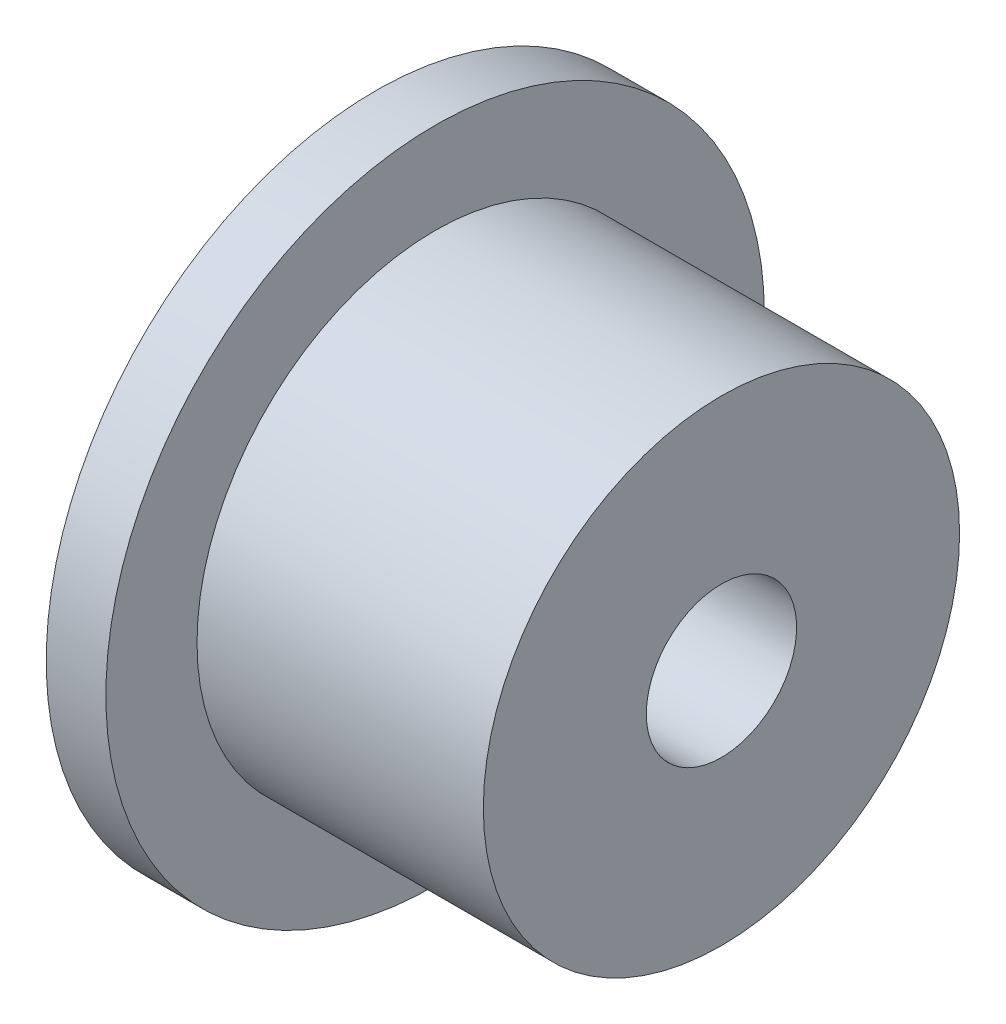
from build123d import *

# Parameters (mm, degrees)
SKETCH2_R           = 4.0005
CUT_EXTRUDE1_DEPTH  = 35.169146436
SKETCH3_R           = 6.35
SKETCH3_R_2         = 4.0005
BOSS_EXTRUDE1_DEPTH = 0.68072


with BuildPart() as part:
    # Sketch1 → Revolve1 (revolve)
    with BuildSketch(Plane.XY, mode=Mode.PRIVATE) as revolve1_sk:
        Polygon((0, 0), (0, 6.35), (5.1054, 6.35), (5.1054, 17.526), (8.2804, 17.526), (8.2804, 12.6746), (23.5204, 12.6746), (23.5204, 0), align=None)
    revolve(revolve1_sk.sketch.rotate(Axis((23.5204, 0, 0), (-1, 0, 0)), 90), axis=Axis((23.5204, 0, 0), (-1, 0, 0)))

    # Sketch2 → Cut-Extrude1 (cut, through all)
    with BuildSketch(Plane.ZY):
        Circle(SKETCH2_R)
    extrude(amount=-CUT_EXTRUDE1_DEPTH, mode=Mode.SUBTRACT)

    # Sketch3 → Boss-Extrude1 (add)
    with BuildSketch(Plane.ZY):
        with Locations(Location((0, 0, 0), (0, 0, 180))):
            Circle(SKETCH3_R)
        Circle(SKETCH3_R_2, mode=Mode.SUBTRACT)
    extrude(amount=BOSS_EXTRUDE1_DEPTH)


solid = part.part
